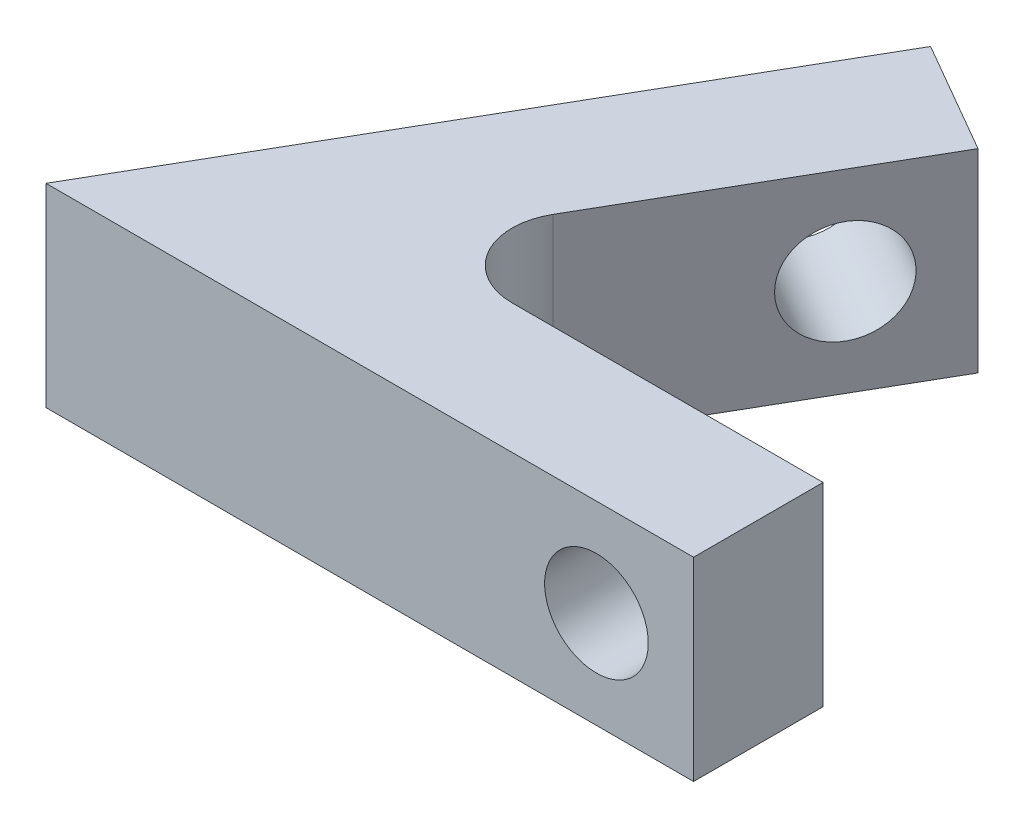
from build123d import *

# Parameters (mm, degrees)
EXTRUDE_1_DEPTH     = 6
CUT_EXTRUDE_1_REACH = 24.514
SKETCH_3_R          = 1.6
FILLET_1_R          = 2


with BuildPart() as part:
    # 草图2 → 凸台-拉伸1 (new body)
    with BuildSketch(Plane(origin=(0, 0, 0), x_dir=(1, 0, 0), z_dir=(0, 1, 0))):
        Polygon((0, 0), (13.07179677, 0), (13.07179677, -4), (-6.92820323, -4), (3.07179677, 13.320508076), (6.535898385, 11.320508076), align=None)
    extrude(amount=EXTRUDE_1_DEPTH)

    # 草图3 → 切除-拉伸1 (cut, up to next)
    with BuildSketch(Plane.XY.offset(4), mode=Mode.PRIVATE) as cut_extrude_1_sk1:
        with Locations((10.07179677, 3)):
            Circle(SKETCH_3_R)
    cut_extrude_1_tool1 = extrude(cut_extrude_1_sk1.sketch, amount=-CUT_EXTRUDE_1_REACH, mode=Mode.PRIVATE) & part.part
    cut_extrude_1 = cut_extrude_1_tool1.solids().sort_by_distance((10.071797, 3, 4))[0]
    add(cut_extrude_1, mode=Mode.SUBTRACT)

    # 镜向1: 切除-拉伸1 across plane
    add(cut_extrude_1.mirror(Plane(origin=(0, 0, 0), x_dir=(-0.8660254037844399, 0, 0.4999999999999978), z_dir=(0.4999999999999983, 0, 0.8660254037844398))), mode=Mode.SUBTRACT)

    # 圆角1
    fillet_1_edges = [part.edges().sort_by_distance(p)[0] for p in [
        (0, 3, 0),
    ]]
    fillet(fillet_1_edges, radius=FILLET_1_R)


solid = part.part
